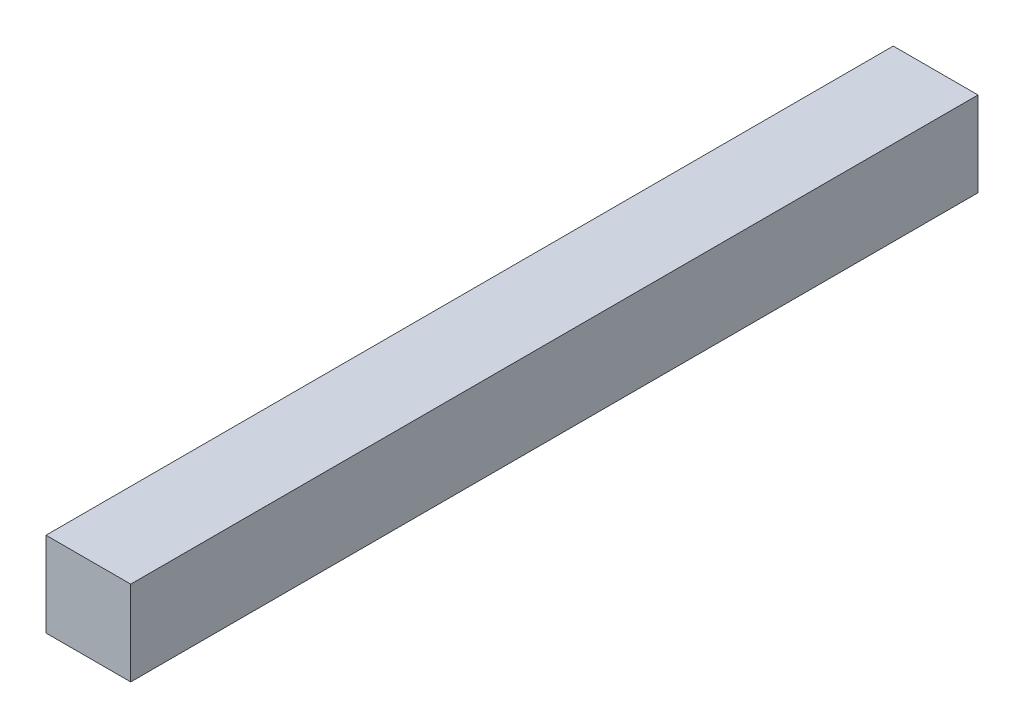
from build123d import *

# Parameters (mm, degrees)
SKETCH1_W           = 6.35
SKETCH1_H           = 6.35
BOSS_EXTRUDE1_DEPTH = 31.75


with BuildPart() as part:
    # Sketch1 → Boss-Extrude1 (new, symmetric)
    with BuildSketch(Plane.XY):
        Rectangle(SKETCH1_W, SKETCH1_H)
    extrude(amount=BOSS_EXTRUDE1_DEPTH, both=True)


solid = part.part
